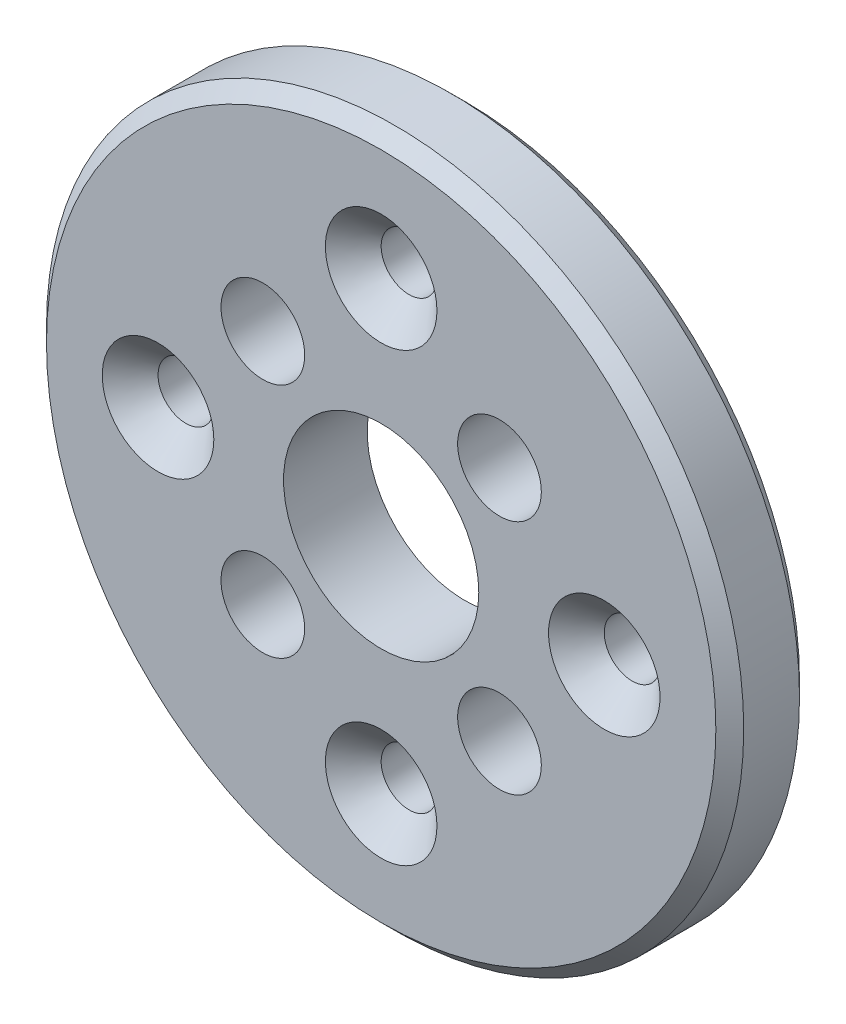
from build123d import *

# Parameters (mm, degrees)
SKETCH_1_R      = 12.5
SKETCH_1_R_2    = 1
SKETCH_1_R_3    = 1.5
SKETCH_1_R_4    = 3.5
EXTRUDE_1_DEPTH = 1.5
CHAMFER_2_SIZE  = 1
CHAMFER_1_SIZE  = 0.5


with BuildPart() as part:
    # 草图1 → 凸台-拉伸1 (new, symmetric)
    with BuildSketch(Plane.XY):
        Circle(SKETCH_1_R)
        with Locations((0, 8)):
            Circle(SKETCH_1_R_2, mode=Mode.SUBTRACT)
        with Locations((8, 0)):
            Circle(SKETCH_1_R_2, mode=Mode.SUBTRACT)
        with Locations((0, -8)):
            Circle(SKETCH_1_R_2, mode=Mode.SUBTRACT)
        with Locations((-8, 0)):
            Circle(SKETCH_1_R_2, mode=Mode.SUBTRACT)
        with Locations((-4.242640687, 4.242640687)):
            Circle(SKETCH_1_R_3, mode=Mode.SUBTRACT)
        Circle(SKETCH_1_R_4, mode=Mode.SUBTRACT)
        with Locations((4.242640687, 4.242640687)):
            Circle(SKETCH_1_R_3, mode=Mode.SUBTRACT)
        with Locations((4.242640687, -4.242640687)):
            Circle(SKETCH_1_R_3, mode=Mode.SUBTRACT)
        with Locations((-4.242640687, -4.242640687)):
            Circle(SKETCH_1_R_3, mode=Mode.SUBTRACT)
    extrude(amount=EXTRUDE_1_DEPTH, both=True)

    # 倒角2
    chamfer_2_edges = [part.edges().sort_by_distance(p)[0] for p in [
        (-1, -8, 1.5),
        (-9, 0, 1.5),
        (-1, 8, 1.5),
        (7, 0, 1.5),
    ]]
    chamfer(chamfer_2_edges, length=CHAMFER_2_SIZE)

    # 倒角1
    chamfer_1_edges = [part.edges().sort_by_distance(p)[0] for p in [
        (-12.5, 0, -1.5),
        (-12.5, 0, 1.5),
    ]]
    chamfer(chamfer_1_edges, length=CHAMFER_1_SIZE)


solid = part.part
